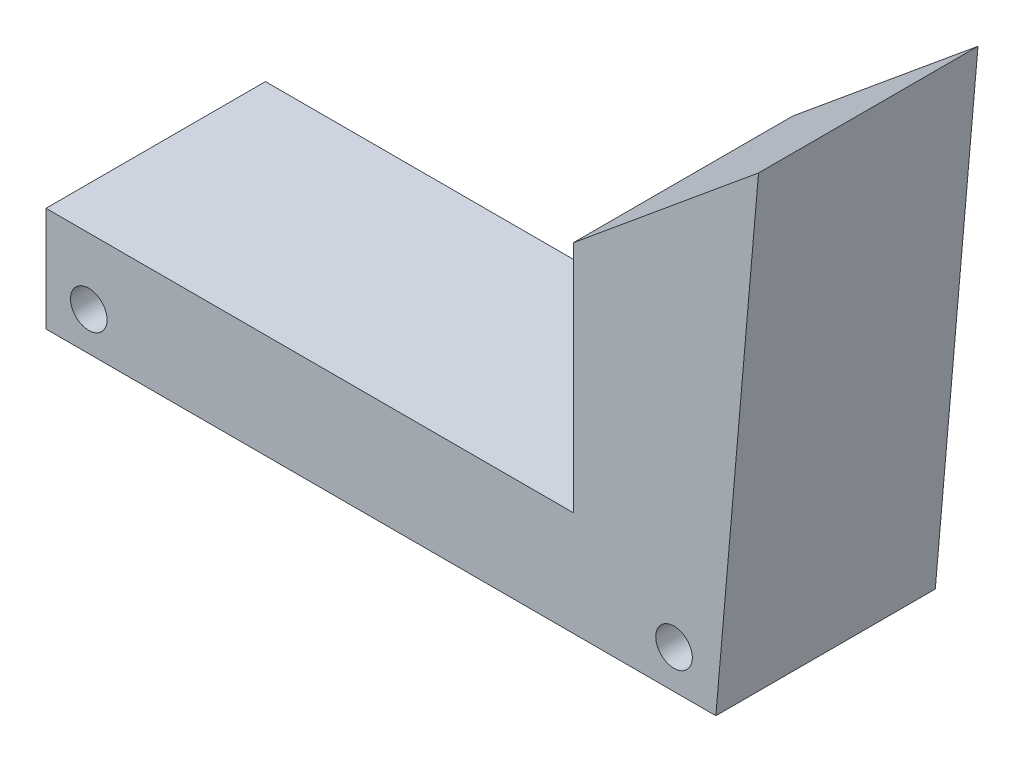
from build123d import *

# Parameters (mm, degrees)
SKETCH1_R           = 3.175
BOSS_EXTRUDE1_DEPTH = 38.1


with BuildPart() as part:
    # Sketch1 → Boss-Extrude1 (new body)
    with BuildSketch(Plane.XY):
        Polygon((-16.056683457, 2.733236781), (100.225653504, 2.733236781), (107.63663241, 88.047008638), (75.491893593, 61.490379753), (75.491893593, 20.88695082), (-16.056683457, 20.88695082), align=None)
        with Locations(Location((-8.634202411, 9.412425764, 0), (0, 0, 180))):
            Circle(SKETCH1_R, mode=Mode.SUBTRACT)
        with Locations(Location((92.965797589, 9.412425764, 0), (0, 0, 180))):
            Circle(SKETCH1_R, mode=Mode.SUBTRACT)
    extrude(amount=BOSS_EXTRUDE1_DEPTH)


solid = part.part
